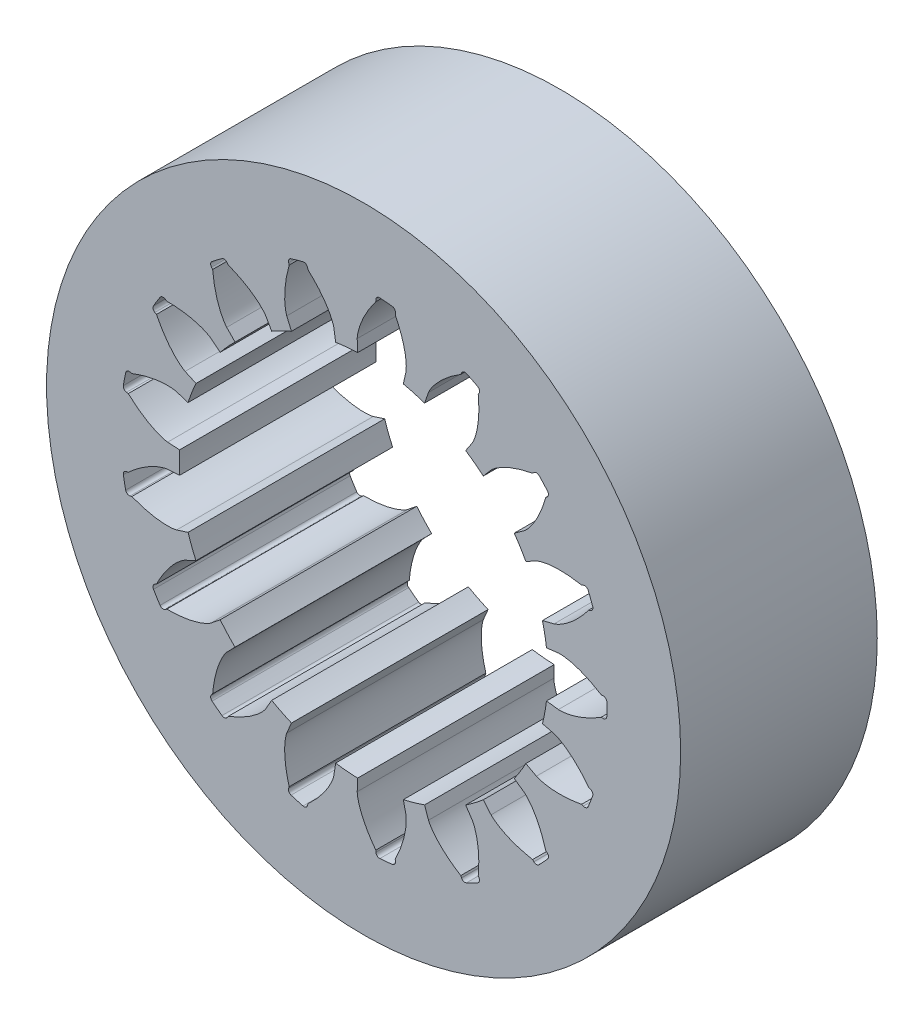
from build123d import *

# Parameters (mm, degrees)
BLANK_SKETCH_R    = 16.125
BLANK_SKETCH_R_2  = 9.375
BLANK_DEPTH       = 10
TOOTH_SPACE_DEPTH = 25.900426703
TEETH_COUNT       = 17


with BuildPart() as part:
    # Blank Sketch → Blank (new body)
    with BuildSketch(Plane.XY):
        Circle(BLANK_SKETCH_R)
        Circle(BLANK_SKETCH_R_2, mode=Mode.SUBTRACT)
    extrude(amount=BLANK_DEPTH)

    # Tooth Space Sketch → Tooth Space (cut, symmetric)
    with BuildSketch(Plane.XY):
        with BuildLine():
            Line((9.906394479, 1.244298557), (8.061655443, 1.012589016))
            Line((8.061655443, 1.012589016), (8.061655443, -1.012589016))
            Line((8.061655443, -1.012589016), (9.906394479, -1.244298557))
            add(Edge.make_bspline(
                [(9.906394479, -1.244298557), (9.909822466, -1.244678867), (9.919453909, -1.245591992), (9.937725474, -1.246711559), (9.967608143, -1.24767476), (10.005767032, -1.247631809), (10.05515288, -1.246116375), (10.113384098, -1.242453433), (10.177397458, -1.236460978), (10.247022519, -1.227820469), (10.316436794, -1.217326273), (10.385608734, -1.20511615), (10.45443124, -1.191383429), (10.537667717, -1.172898147), (10.637276342, -1.148161722), (10.753330944, -1.115517317), (10.884452767, -1.074099669), (11.017439011, -1.027216594), (11.147727349, -0.977252121), (11.278602336, -0.922396619), (11.404681884, -0.866223355), (11.534727097, -0.803440429), (11.654310491, -0.743227461), (11.787155577, -0.670904087), (11.894042593, -0.611113705), (12.003432915, -0.545329192), (12.056518977, -0.512719929), (12.083582473, -0.49580609)],
                knots=[0, 0, 0, 0, 0, 0.005376749, 0.015083688, 0.02853182, 0.04661014, 0.064854849, 0.092110525, 0.119476176, 0.146842496, 0.174208854, 0.201574956, 0.228941013, 0.256307345, 0.307035032, 0.361767352, 0.416499661, 0.471231937, 0.525964282, 0.580696616, 0.635428982, 0.690161387, 0.744893688, 0.799626082, 0.854358408, 0.909090915, 0.909090915, 0.909090915, 0.909090915, 0.909090915], degree=4))
            Line((12.083582473, -0.49580609), (12.175812475, -0.499590414))
            ThreePointArc((12.175812475, -0.499590414), (12.311592068, -0.449173271), (12.370937843, -0.317051867))
            ThreePointArc((12.370937843, -0.317051867), (12.375, 0), (12.370937843, 0.317051867))
            ThreePointArc((12.370937843, 0.317051867), (12.311592068, 0.449173271), (12.175812475, 0.499590414))
            Line((12.175812475, 0.499590414), (12.083582473, 0.49580609))
            add(Edge.make_bspline(
                [(9.906394479, 1.244298557), (9.909822466, 1.244678867), (9.919453909, 1.245591992), (9.937725474, 1.246711559), (9.967608143, 1.24767476), (10.005767032, 1.247631809), (10.05515288, 1.246116375), (10.113384098, 1.242453433), (10.177397458, 1.236460978), (10.247022519, 1.227820469), (10.316436794, 1.217326273), (10.385608734, 1.20511615), (10.45443124, 1.191383429), (10.537667717, 1.172898147), (10.637276342, 1.148161722), (10.753330944, 1.115517317), (10.884452767, 1.074099669), (11.017439011, 1.027216594), (11.147727349, 0.977252121), (11.278602336, 0.922396619), (11.404681884, 0.866223355), (11.534727097, 0.803440429), (11.654310491, 0.743227461), (11.787155577, 0.670904087), (11.894042593, 0.611113705), (12.003432915, 0.545329192), (12.056518977, 0.512719929), (12.083582473, 0.49580609)],
                knots=[0, 0, 0, 0, 0, 0.005376749, 0.015083688, 0.02853182, 0.04661014, 0.064854849, 0.092110525, 0.119476176, 0.146842496, 0.174208854, 0.201574956, 0.228941013, 0.256307345, 0.307035032, 0.361767352, 0.416499661, 0.471231937, 0.525964282, 0.580696616, 0.635428982, 0.690161387, 0.744893688, 0.799626082, 0.854358408, 0.909090915, 0.909090915, 0.909090915, 0.909090915, 0.909090915], degree=4))
        make_face()
    tooth_space = extrude(amount=TOOTH_SPACE_DEPTH, both=True, mode=Mode.SUBTRACT)

    # Teeth: Tooth Space ×17 about axis
    teeth_axis = Axis((0, 0, -0.50007105), (0, 0, 1))
    for i in range(1, TEETH_COUNT):
        add(tooth_space.rotate(teeth_axis, i * 360 / TEETH_COUNT), mode=Mode.SUBTRACT)


solid = part.part
